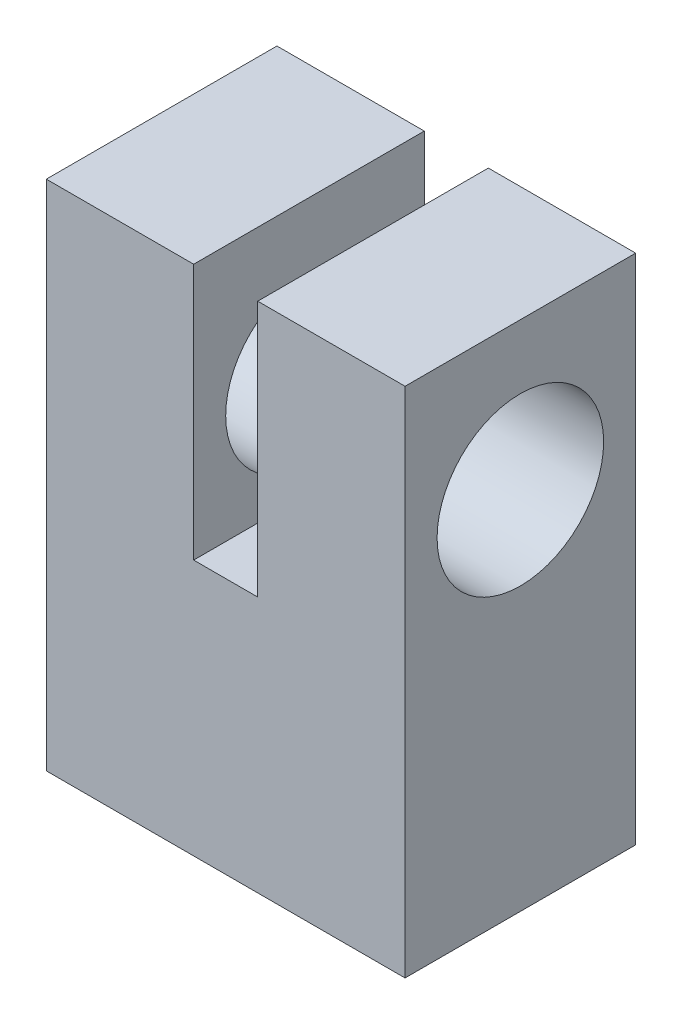
from build123d import *

# Parameters (mm, degrees)
SKETCH_1_W          = 28
SKETCH_1_H          = 18
EXTRUDE_1_DEPTH     = 40
SKETCH_2_R          = 2
CUT_EXTRUDE_1_DEPTH = 15
SKETCH_4_R          = 7.5
CUT_EXTRUDE_2_DEPTH = 1.2
SKETCH_5_R          = 6.5
CUT_EXTRUDE_3_DEPTH = 3.2
CUT_EXTRUDE_4_REACH = 51.809
SKETCH_6_R          = 2.5
CUT_EXTRUDE_START   = -1.2
SKETCH_7_R          = 7.5
CUT_EXTRUDE_5_DEPTH = 1.2
CUT_EXTRUDE_START_2 = -3.2
SKETCH_8_R          = 6.5
CUT_EXTRUDE_6_DEPTH = 3.2
CUT_EXTRUDE_7_DEPTH = 53.038447325
EXTRUDE_START       = 1.2
SKETCH_10_R         = 7.5
SKETCH_10_R_2       = 6.5
EXTRUDE_2_DEPTH     = 1.2
SKETCH_11_R         = 7.5
SKETCH_11_R_2       = 6.5
EXTRUDE_3_DEPTH     = 1.2
CUT_EXTRUDE_START_3 = -19.2
SKETCH_12_R         = 6.5
CUT_EXTRUDE_8_DEPTH = 19.2


with BuildPart() as part:
    # 草图1 → 凸台-拉伸1 (new body)
    with BuildSketch(Plane(origin=(0, 0, 0), x_dir=(1, 0, 0), z_dir=(0, 1, 0))):
        with Locations((14, 9)):
            Rectangle(SKETCH_1_W, SKETCH_1_H)
    extrude(amount=EXTRUDE_1_DEPTH)

    # 草图2 → 切除-拉伸1 (cut)
    with BuildSketch(Plane.XZ):
        with Locations(Location((6, -5.5, 0), (0, 0, 270))):
            Circle(SKETCH_2_R)
        with Locations(Location((6, -12.5, 0), (0, 0, 270))):
            Circle(SKETCH_2_R)
        with Locations(Location((22, -12.5, 0), (0, 0, 90))):
            Circle(SKETCH_2_R)
        with Locations(Location((22, -5.5, 0), (0, 0, 90))):
            Circle(SKETCH_2_R)
    extrude(amount=-CUT_EXTRUDE_1_DEPTH, mode=Mode.SUBTRACT)

    # 草图4 → 切除-拉伸2 (cut)
    with BuildSketch(Plane(origin=(28, 0, 0), x_dir=(0, 0, -1), z_dir=(1, 0, 0))):
        with Locations((9, 28.5)):
            Circle(SKETCH_4_R)
    extrude(amount=-CUT_EXTRUDE_2_DEPTH, mode=Mode.SUBTRACT)

    # 草图5 → 切除-拉伸3 (cut)
    with BuildSketch(Plane(origin=(26.8, 0, 0), x_dir=(0, 0, -1), z_dir=(1, 0, 0))):
        with Locations((9, 28.5)):
            Circle(SKETCH_5_R)
    extrude(amount=-CUT_EXTRUDE_3_DEPTH, mode=Mode.SUBTRACT)

    # 草图6 → 切除-拉伸4 (cut, up to next)
    with BuildSketch(Plane(origin=(23.6, 0, 0), x_dir=(0, 0, -1), z_dir=(1, 0, 0)), mode=Mode.PRIVATE) as cut_extrude_4_sk1:
        with Locations((9, 28.5)):
            Circle(SKETCH_6_R)
    cut_extrude_4_tool1 = extrude(cut_extrude_4_sk1.sketch, amount=-CUT_EXTRUDE_4_REACH, mode=Mode.PRIVATE) & part.part
    add(cut_extrude_4_tool1.solids().sort_by_distance((23.6, 28.5, -9))[0], mode=Mode.SUBTRACT)

    # 草图7 → 切除-拉伸5 (cut)
    with BuildSketch(Plane.ZY.offset(CUT_EXTRUDE_START)):
        with Locations(Location((-9, 28.5, 0), (0, 0, 180))):
            Circle(SKETCH_7_R)
    extrude(amount=CUT_EXTRUDE_5_DEPTH, mode=Mode.SUBTRACT)

    # 草图8 → 切除-拉伸6 (cut)
    with BuildSketch(Plane.ZY.offset(-1.2).offset(CUT_EXTRUDE_START_2)):
        with Locations(Location((-9, 28.5, 0), (0, 0, 180))):
            Circle(SKETCH_8_R)
    extrude(amount=CUT_EXTRUDE_6_DEPTH, mode=Mode.SUBTRACT)

    # 草图9 → 切除-拉伸7 (cut, through all)
    with BuildSketch(Plane.XY):
        Polygon((14, 40), (11.5, 40), (11.5, 20), (16.5, 20), (16.5, 40), align=None)
    extrude(amount=-CUT_EXTRUDE_7_DEPTH, mode=Mode.SUBTRACT)

    # 草图10 → 凸台-拉伸2 (add)
    with BuildSketch(Plane(origin=(26.8, 0, 0), x_dir=(0, 0, -1), z_dir=(1, 0, 0)).offset(EXTRUDE_START)):
        with Locations(Location((9, 28.5, 0), (0, 0, 180))):
            Circle(SKETCH_10_R)
        with Locations((9, 28.5)):
            Circle(SKETCH_10_R_2, mode=Mode.SUBTRACT)
    extrude(amount=-EXTRUDE_2_DEPTH)

    # 草图11 → 凸台-拉伸3 (add)
    with BuildSketch(Plane.ZY.offset(-1.2)):
        with Locations((-9, 28.5)):
            Circle(SKETCH_11_R)
        with Locations(Location((-9, 28.5, 0), (0, 0, 180))):
            Circle(SKETCH_11_R_2, mode=Mode.SUBTRACT)
    extrude(amount=EXTRUDE_3_DEPTH)

    # 草图12 → 切除-拉伸8 (cut)
    with BuildSketch(Plane.ZY.offset(-4.4).offset(CUT_EXTRUDE_START_3)):
        with Locations(Location((-9, 28.5, 0), (0, 0, 180))):
            Circle(SKETCH_12_R)
    extrude(amount=CUT_EXTRUDE_8_DEPTH, mode=Mode.SUBTRACT)


solid = part.part
